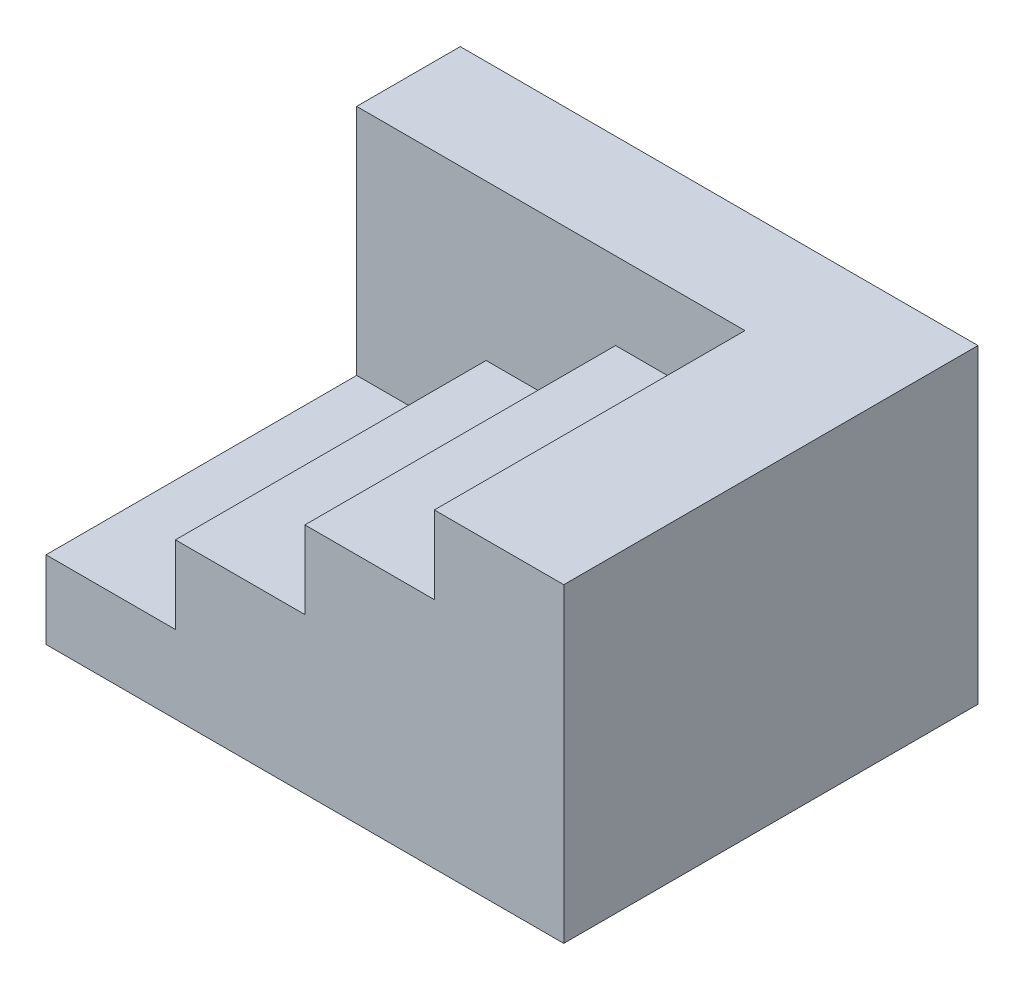
from build123d import *

# Parameters (mm, degrees)
SKETCH1_W           = 100
SKETCH1_H           = 80
BOSS_EXTRUDE1_DEPTH = 60
CUT_EXTRUDE1_DEPTH  = 60


with BuildPart() as part:
    # Sketch1 → Boss-Extrude1 (new body)
    with BuildSketch(Plane(origin=(0, 0, 0), x_dir=(1, 0, 0), z_dir=(0, 1, 0))):
        with Locations((-14.70444179, 5.145771165)):
            Rectangle(SKETCH1_W, SKETCH1_H)
    extrude(amount=-BOSS_EXTRUDE1_DEPTH)

    # Sketch3 → Cut-Extrude1 (cut)
    with BuildSketch(Plane.XY.offset(34.854228835)):
        Polygon((-64.70444179, 0), (10.29555821, 0), (10.29555821, -15), (-14.70444179, -15), (-14.70444179, -30), (-39.70444179, -30), (-39.70444179, -45), (-64.70444179, -45), align=None)
    extrude(amount=-CUT_EXTRUDE1_DEPTH, mode=Mode.SUBTRACT)


solid = part.part
